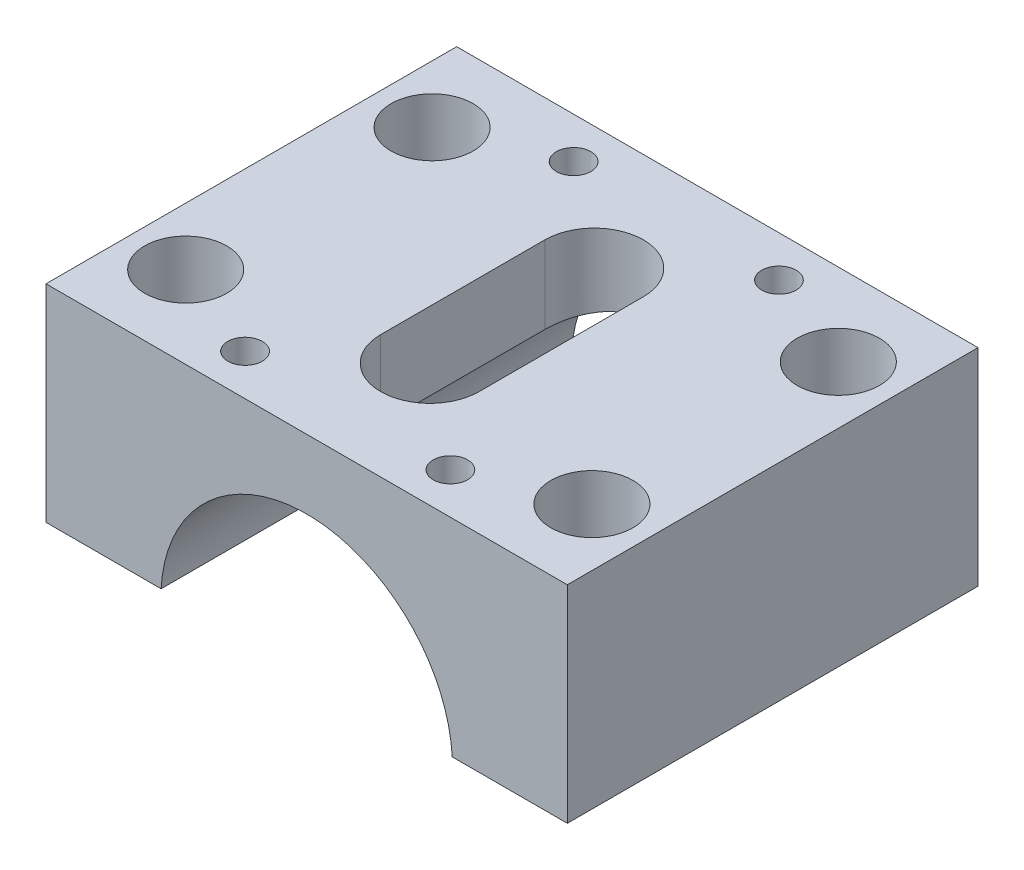
from build123d import *

# Parameters (mm, degrees)
BOSS_EXTRUDE1_DEPTH             = 50
BOSS_EXTRUDE2_START             = -50
BOSS_EXTRUDE2_DEPTH             = 50
F_5_0MM_CLEARANCE_DOWEL_HOLE1_D = 5
CUT_EXTRUDE1_REACH              = 67.4
SKETCH4_R                       = 5
CUT_EXTRUDE2_REACH              = 68.728
CUT_EXTRUDE3_DEPTH              = 68.194679971
TAP_DRILL_FOR_M5X0_8_TAP1_D     = 4.2
TAP_DRILL_FOR_M5X0_8_TAP1_DEPTH = 8
TAP_DRILL_FOR_M5X0_8_TAP1_TIP   = 1.2618073


with BuildPart() as part:
    # Sketch1 → Boss-Extrude1 (new body)
    with BuildSketch(Plane.XY):
        with BuildLine():
            Line((-31.734248061, 1), (-17.721808598, 1))
            ThreePointArc((-17.721808598, 1), (0, 17.75), (17.721808598, 1))
            Line((17.721808598, 1), (31.734248061, 1))
            ThreePointArc((31.734248061, 1), (0, 31.75), (-31.734248061, 1))
        make_face()
    extrude(amount=BOSS_EXTRUDE1_DEPTH)

    # Sketch9 → Boss-Extrude2 (add)
    with BuildSketch(Plane.XY.offset(50).offset(BOSS_EXTRUDE2_START)):
        with BuildLine():
            Line((31.734248061, 31.75), (0, 31.75))
            ThreePointArc((0, 31.75), (22.094258304, 22.801452805), (31.734248061, 1))
            Line((31.734248061, 1), (31.734248061, 31.75))
        make_face()
        with BuildLine():
            Line((-31.734248061, 31.75), (-31.734248061, 1))
            ThreePointArc((-31.734248061, 1), (-22.094258304, 22.801452805), (0, 31.75))
            Line((0, 31.75), (-31.734248061, 31.75))
        make_face()
    extrude(amount=BOSS_EXTRUDE2_DEPTH)

    # Ø5.0mm Clearance Dowel Hole1 (through all)
    with Locations(Plane(origin=(-24.72802833, 1, 40), x_dir=(0, 0, -1), z_dir=(0, -1, 0))):
        with Locations((0, 0), (30, 0), (0, 49.45605666), (30, 49.45605666)):
            Hole(F_5_0MM_CLEARANCE_DOWEL_HOLE1_D / 2)

    # Sketch4 → Cut-Extrude1 (cut, up to next)
    with BuildSketch(Plane(origin=(0, 4, 0), x_dir=(-1, 0, 0), z_dir=(0, -1, 0)), mode=Mode.PRIVATE) as cut_extrude1_sk1:
        with Locations(Location((24.72802833, -40, 0), (0, 0, 90))):
            Circle(SKETCH4_R)
    cut_extrude1_tool1 = extrude(cut_extrude1_sk1.sketch, amount=-CUT_EXTRUDE1_REACH, mode=Mode.PRIVATE) & part.part
    # Sketch4 → Cut-Extrude1 (cut, up to next)
    with BuildSketch(Plane(origin=(0, 4, 0), x_dir=(-1, 0, 0), z_dir=(0, -1, 0)), mode=Mode.PRIVATE) as cut_extrude1_sk2:
        with Locations(Location((24.72802833, -10, 0), (0, 0, 90))):
            Circle(SKETCH4_R)
    cut_extrude1_tool2 = extrude(cut_extrude1_sk2.sketch, amount=-CUT_EXTRUDE1_REACH, mode=Mode.PRIVATE) & part.part
    # Sketch4 → Cut-Extrude1 (cut, up to next)
    with BuildSketch(Plane(origin=(0, 4, 0), x_dir=(-1, 0, 0), z_dir=(0, -1, 0)), mode=Mode.PRIVATE) as cut_extrude1_sk3:
        with Locations(Location((-24.72802833, -10, 0), (0, 0, 90))):
            Circle(SKETCH4_R)
    cut_extrude1_tool3 = extrude(cut_extrude1_sk3.sketch, amount=-CUT_EXTRUDE1_REACH, mode=Mode.PRIVATE) & part.part
    # Sketch4 → Cut-Extrude1 (cut, up to next)
    with BuildSketch(Plane(origin=(0, 4, 0), x_dir=(-1, 0, 0), z_dir=(0, -1, 0)), mode=Mode.PRIVATE) as cut_extrude1_sk4:
        with Locations(Location((-24.72802833, -40, 0), (0, 0, 90))):
            Circle(SKETCH4_R)
    cut_extrude1_tool4 = extrude(cut_extrude1_sk4.sketch, amount=-CUT_EXTRUDE1_REACH, mode=Mode.PRIVATE) & part.part
    add(cut_extrude1_tool1.solids().sort_by_distance((-24.728028, 4, 40))[0], mode=Mode.SUBTRACT)
    add(cut_extrude1_tool2.solids().sort_by_distance((-24.728028, 4, 10))[0], mode=Mode.SUBTRACT)
    add(cut_extrude1_tool3.solids().sort_by_distance((24.728028, 4, 10))[0], mode=Mode.SUBTRACT)
    add(cut_extrude1_tool4.solids().sort_by_distance((24.728028, 4, 40))[0], mode=Mode.SUBTRACT)

    # Sketch5 → Cut-Extrude2 (cut, up to next)
    with BuildSketch(Plane(origin=(0, 1, 0), x_dir=(-1, 0, 0), z_dir=(0, -1, 0)), mode=Mode.PRIVATE) as cut_extrude2_sk1:
        with BuildLine():
            Line((-6, -35), (-6, -15))
            ThreePointArc((-6, -15), (0, -9), (6, -15))
            Line((6, -15), (6, -35))
            ThreePointArc((6, -35), (0, -41), (-6, -35))
        make_face()
    cut_extrude2_tool1 = extrude(cut_extrude2_sk1.sketch, amount=-CUT_EXTRUDE2_REACH, mode=Mode.PRIVATE) & part.part
    add(cut_extrude2_tool1.solids().sort_by_distance((0, 1, 25))[0], mode=Mode.SUBTRACT)

    # Sketch6 → Cut-Extrude3 (cut, through all)
    with BuildSketch(Plane.XY.offset(50)):
        with BuildLine():
            ThreePointArc((0, 31.75), (9.424816043, 30.318894151), (18, 26.154588508))
            Line((18, 26.154588508), (31.734248061, 26.154588508))
            Line((31.734248061, 26.154588508), (31.734248061, 31.75))
            Line((31.734248061, 31.75), (0, 31.75))
        make_face()
        with BuildLine():
            Line((18, 26.154588508), (-18, 26.154588508))
            ThreePointArc((-18, 26.154588508), (0, 31.75), (18, 26.154588508))
        make_face()
        with BuildLine():
            Line((-31.734248061, 26.154588508), (-18, 26.154588508))
            ThreePointArc((-18, 26.154588508), (-9.424816043, 30.318894151), (0, 31.75))
            Line((0, 31.75), (-31.734248061, 31.75))
            Line((-31.734248061, 31.75), (-31.734248061, 26.154588508))
        make_face()
    extrude(amount=-CUT_EXTRUDE3_DEPTH, mode=Mode.SUBTRACT)

    # Tap Drill for M5x0.8 Tap1
    with Locations(Plane(origin=(-12.5, 26.154588508, 5), x_dir=(0, 0, 1), z_dir=(0, 1, 0))):
        with Locations((0, 0), (40, 0), (40, 25), (0, 25)):
            Hole(TAP_DRILL_FOR_M5X0_8_TAP1_D / 2, depth=TAP_DRILL_FOR_M5X0_8_TAP1_DEPTH)
            with Locations((0, 0, -(TAP_DRILL_FOR_M5X0_8_TAP1_DEPTH + TAP_DRILL_FOR_M5X0_8_TAP1_TIP / 2))):  # 118° drill point
                Cone(0, TAP_DRILL_FOR_M5X0_8_TAP1_D / 2, TAP_DRILL_FOR_M5X0_8_TAP1_TIP, mode=Mode.SUBTRACT)


solid = part.part
